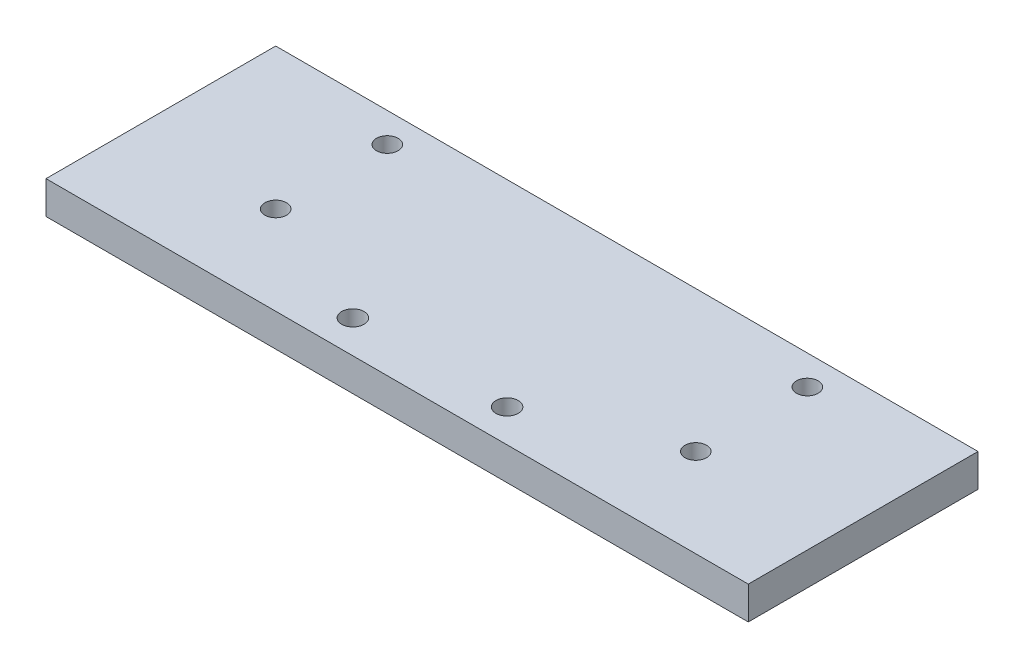
from build123d import *

# Parameters (mm, degrees)
SKETCH_1_W          = 107
SKETCH_1_H          = 35
EXTRUDE_1_DEPTH     = 5
SKETCH_2_R          = 1.7
SKETCH_2_R_2        = 1.65
CUT_EXTRUDE_1_DEPTH = 5


with BuildPart() as part:
    # 草图1 → 凸台-拉伸1 (new body)
    with BuildSketch(Plane(origin=(0, 0, 0), x_dir=(1, 0, 0), z_dir=(0, 1, 0))):
        with Locations((19.050314465, -4.017295597)):
            Rectangle(SKETCH_1_W, SKETCH_1_H)
    extrude(amount=EXTRUDE_1_DEPTH)

    # 草图2 → 切除-拉伸1 (cut)
    with BuildSketch(Plane(origin=(0, 5, 0), x_dir=(1, 0, 0), z_dir=(0, 1, 0))):
        with Locations(Location((7.300314465, -16.517295597, 0), (0, 0, 270))):
            Circle(SKETCH_2_R)
        with Locations(Location((-12.949685535, 8.982704403, 0), (0, 0, 270))):
            Circle(SKETCH_2_R_2)
        with Locations(Location((-12.949685535, -8.017295597, 0), (0, 0, 90))):
            Circle(SKETCH_2_R_2)
        with Locations(Location((30.800314465, -16.517295597, 0), (0, 0, 90))):
            Circle(SKETCH_2_R)
        with Locations(Location((51.050314465, -8.017295597, 0), (0, 0, 270))):
            Circle(SKETCH_2_R_2)
        with Locations(Location((51.050314465, 8.982704403, 0), (0, 0, 90))):
            Circle(SKETCH_2_R_2)
    extrude(amount=-CUT_EXTRUDE_1_DEPTH, mode=Mode.SUBTRACT)


solid = part.part
